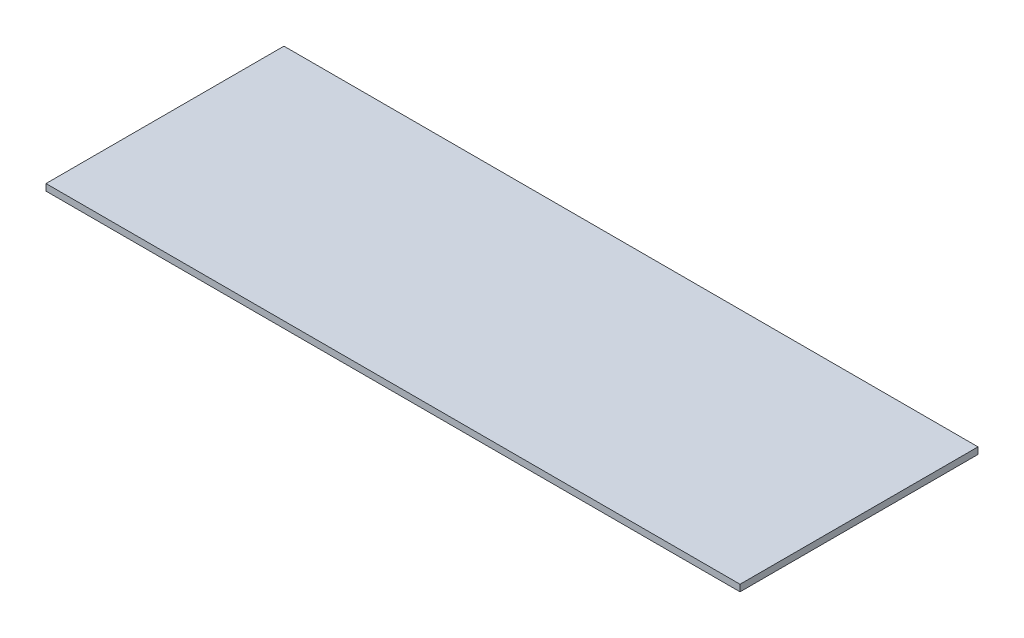
from build123d import *

# Parameters (mm, degrees)
SKETCH1_W           = 210
SKETCH1_H           = 72
BOSS_EXTRUDE1_DEPTH = 1


with BuildPart() as part:
    # Sketch1 → Boss-Extrude1 (new, symmetric)
    with BuildSketch(Plane(origin=(0, 0, 0), x_dir=(1, 0, 0), z_dir=(0, 1, 0))):
        Rectangle(SKETCH1_W, SKETCH1_H)
    extrude(amount=BOSS_EXTRUDE1_DEPTH, both=True)


solid = part.part
